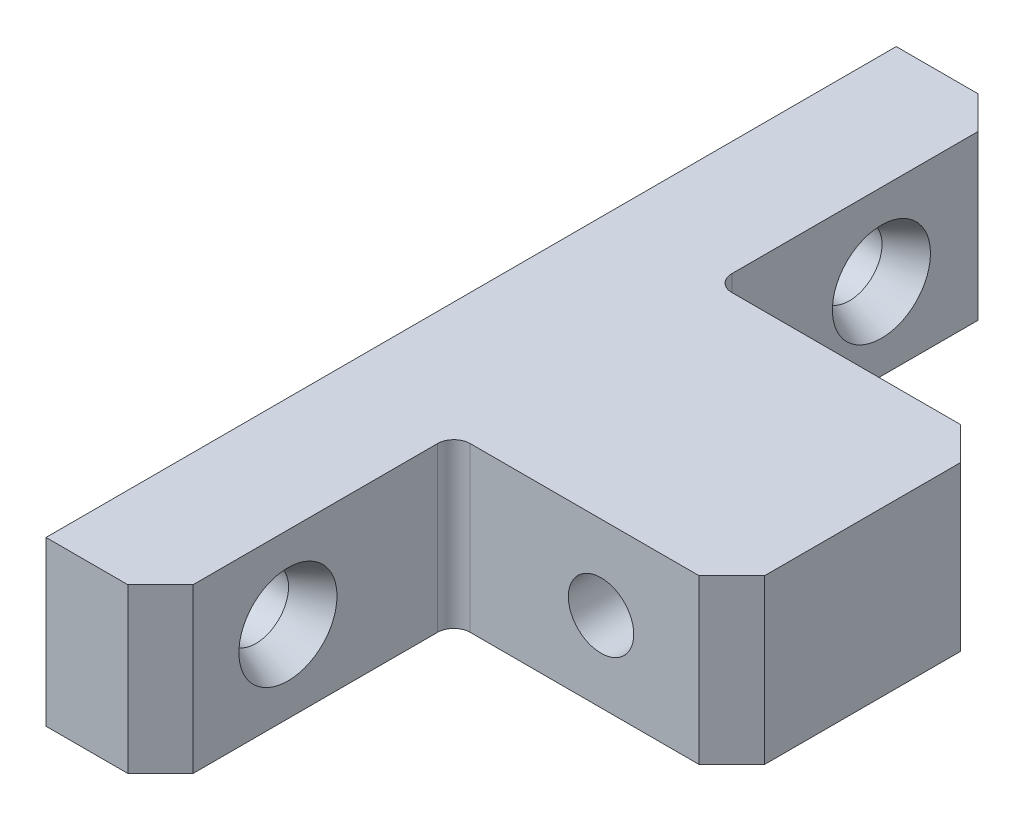
from build123d import *

# Parameters (mm, degrees)
SKETCH_1_W                    = 52
SKETCH_1_H                    = 10
EXTRUDE_1_DEPTH               = 24
SKETCH_2_W                    = 23.570504403
SKETCH_2_H                    = 14.285983016
SKETCH_2_W_2                  = 23.570504402
CUT_EXTRUDE_1_DEPTH           = 17
FILLET_1_R                    = 1
CHAMFER_1_SIZE                = 2
SKETCH_3_R                    = 2
CUT_EXTRUDE_2_DEPTH           = 32.480923073
SKETCH_4_R                    = 2
CUT_EXTRUDE_3_DEPTH           = 42.973818432
SKETCH_5_R                    = 3
CUT_EXTRUDE_4_DEPTH           = 2
CUT_EXTRUDE_4_DRAFT           = -27
CUT_EXTRUDE_4_PROFILE_2_DEPTH = 2
CUT_EXTRUDE_4_PROFILE_2_DRAFT = -27
SKETCH_6_R                    = 2
CUT_EXTRUDE_2_2_DEPTH         = 10


with BuildPart() as part:
    # Эскиз1 → Вытянуть1 (new body)
    with BuildSketch(Plane(origin=(0, 0, 0), x_dir=(0, 0, -1), z_dir=(1, 0, 0))):
        with Locations((0, 0.103774831)):
            Rectangle(SKETCH_1_W, SKETCH_1_H)
    extrude(amount=EXTRUDE_1_DEPTH)

    # Эскиз2 → Вырез-Вытянуть1 (cut)
    with BuildSketch(Plane(origin=(24, 0, 0), x_dir=(0, 0, -1), z_dir=(1, 0, 0))):
        with Locations((-19.840397425, -1.378733322)):
            Rectangle(SKETCH_2_W, SKETCH_2_H)
        with Locations((19.730106978, -1.378733322)):
            Rectangle(SKETCH_2_W_2, SKETCH_2_H)
    extrude(amount=-CUT_EXTRUDE_1_DEPTH, mode=Mode.SUBTRACT)

    # Скругление1
    fillet_1_edges = [part.edges().sort_by_distance(p)[0] for p in [
        (7, 0.103774831, 8.055145223),
        (7, 0.103774831, -7.944854777),
    ]]
    fillet(fillet_1_edges, radius=FILLET_1_R)

    # Фаска1
    chamfer_1_edges = [part.edges().sort_by_distance(p)[0] for p in [
        (24, 0.103774831, 8.055145223),
        (7, 0.103774831, 26),
        (24, 0.103774831, -7.944854777),
        (7, 0.103774831, -26),
    ]]
    chamfer(chamfer_1_edges, length=CHAMFER_1_SIZE)

    # Эскиз3 → Cut-Extrude 2 (cut, through all)
    with BuildSketch(Plane(origin=(7, 0, 0), x_dir=(0, 0, -1), z_dir=(1, 0, 0))):
        with Locations((-18.202696524, 0.103774831)):
            Circle(SKETCH_3_R)
        with Locations((18.092406077, 0.103774831)):
            Circle(SKETCH_3_R)
    extrude(amount=-CUT_EXTRUDE_2_DEPTH, mode=Mode.SUBTRACT)

    # Эскиз4 → Вырез-Вытянуть3 (cut, through all)
    with BuildSketch(Plane.XY.offset(8.055145223)):
        with Locations((16, 0)):
            Circle(SKETCH_4_R)
    extrude(amount=-CUT_EXTRUDE_3_DEPTH, mode=Mode.SUBTRACT)


with BuildPart() as cut_extrude_4_tool:
    # Эскиз5 → Вырез-Вытянуть4 (with draft: the straight prism first)
    with BuildSketch(Plane(origin=(7, 0, 0), x_dir=(0, 0, -1), z_dir=(1, 0, 0))):
        with Locations((-18.202696524, 0.103774831)):
            Circle(SKETCH_5_R)
    extrude(amount=-CUT_EXTRUDE_4_DEPTH)
    # Вырез-Вытянуть4: the draft: its side faces are tilted about the plane it starts from
    cut_extrude_4_sides = [cut_extrude_4_tool.faces().sort_by_distance(p)[0] for p in [
        (6, 0.103774831, 21.202696524),
    ]]
    draft(cut_extrude_4_sides, Plane(origin=(7, 0, 0), x_dir=(0, 0, -1), z_dir=(1, 0, 0)), CUT_EXTRUDE_4_DRAFT)


with BuildPart() as part_1:
    add(part.part)

    # Вырез-Вытянуть4: cut by cut_extrude_4_tool
    add(cut_extrude_4_tool.part, mode=Mode.SUBTRACT)


with BuildPart() as cut_extrude_4_profile_2_tool:
    # Эскиз5 → Вырез-Вытянуть4 profile 2 (with draft: the straight prism first)
    with BuildSketch(Plane(origin=(7, 0, 0), x_dir=(0, 0, -1), z_dir=(1, 0, 0))):
        with Locations((18.092406077, 0.103774831)):
            Circle(SKETCH_5_R)
    extrude(amount=-CUT_EXTRUDE_4_PROFILE_2_DEPTH)
    # Вырез-Вытянуть4 profile 2: the draft: its side faces are tilted about the plane it starts from
    cut_extrude_4_profile_2_sides = [cut_extrude_4_profile_2_tool.faces().sort_by_distance(p)[0] for p in [
        (6, 0.103774831, -15.092406077),
    ]]
    draft(cut_extrude_4_profile_2_sides, Plane(origin=(7, 0, 0), x_dir=(0, 0, -1), z_dir=(1, 0, 0)), CUT_EXTRUDE_4_PROFILE_2_DRAFT)


with BuildPart() as part_2:
    add(part_1.part)

    # Вырез-Вытянуть4 profile 2: cut by cut_extrude_4_profile_2_tool
    add(cut_extrude_4_profile_2_tool.part, mode=Mode.SUBTRACT)

    # Эскиз6 → Cut-Extrude 2 2 (cut)
    with BuildSketch(Plane.ZY):
        Circle(SKETCH_6_R)
    extrude(amount=-CUT_EXTRUDE_2_2_DEPTH, mode=Mode.SUBTRACT)


solid = part_2.part
